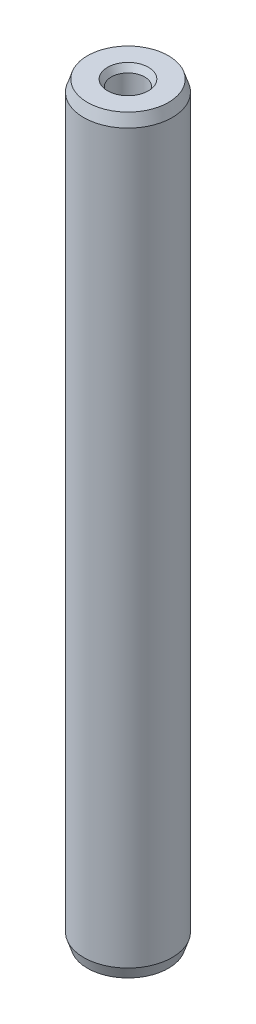
from build123d import *


with BuildPart() as part:
    # Sketch1 → Revolve1 (revolve)
    with BuildSketch(Plane(origin=(0, 0, -1.126435958), x_dir=(-1, 0, 0), z_dir=(0, 0, -1)), mode=Mode.PRIVATE) as revolve1_sk:
        Polygon((-0.064377258, -17.199063069), (1.065922742, -16.519910311), (1.065922742, 21.491784173), (-0.064377258, 22.170936931), (-0.064377258, 27.445996026), (-0.318377258, 27.885936931), (-1.677277258, 27.885936931), (-1.931277258, 27.123936931), (-1.931277258, -22.152063069), (-1.677277258, -22.914063069), (-0.318377258, -22.914063069), (-0.064377258, -22.474122164), align=None)
    revolve(revolve1_sk.sketch.rotate(Axis((-1.065922742, -22.914063069, -1.126435958), (0, 1, 0)), 270), axis=Axis((-1.065922742, -22.914063069, -1.126435958), (0, 1, 0)))


solid = part.part
